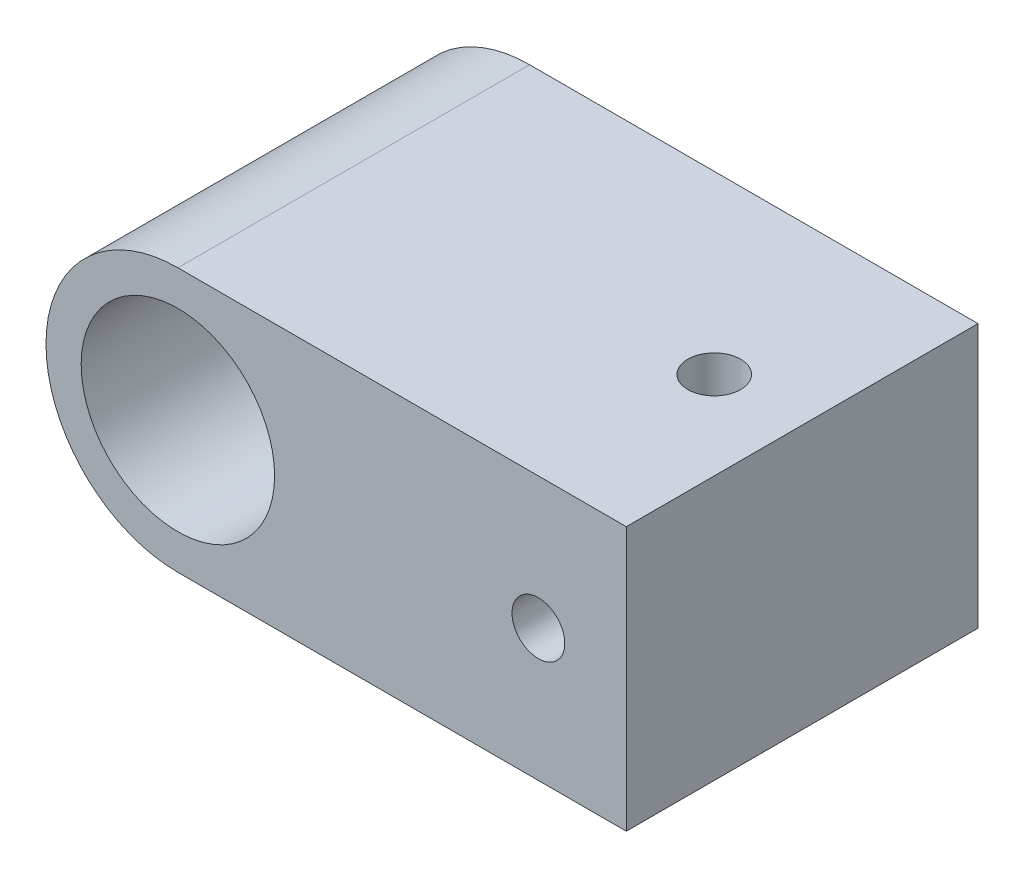
from build123d import *

# Parameters (mm, degrees)
SKETCH1_R           = 7.5
BOSS_EXTRUDE1_DEPTH = 20
SKETCH2_W           = 20
SKETCH2_H           = 15
BOSS_EXTRUDE2_DEPTH = 25.5
SKETCH3_R           = 5.5
CUT_EXTRUDE1_DEPTH  = 26
SKETCH4_R           = 1.5
CUT_EXTRUDE2_DEPTH  = 30
SKETCH5_R           = 1.5
CUT_EXTRUDE3_DEPTH  = 30


with BuildPart() as part:
    # Sketch1 → Boss-Extrude1 (new body)
    with BuildSketch(Plane.XY):
        Circle(SKETCH1_R)
    extrude(amount=BOSS_EXTRUDE1_DEPTH)

    # Sketch2 → Boss-Extrude2 (add)
    with BuildSketch(Plane(origin=(0, 0, 0), x_dir=(0, 0, -1), z_dir=(1, 0, 0))):
        with Locations((-10, 0)):
            Rectangle(SKETCH2_W, SKETCH2_H)
    extrude(amount=BOSS_EXTRUDE2_DEPTH)

    # Sketch3 → Cut-Extrude1 (cut)
    with BuildSketch(Plane.XY.offset(20)):
        Circle(SKETCH3_R)
    extrude(amount=-CUT_EXTRUDE1_DEPTH, mode=Mode.SUBTRACT)

    # Sketch4 → Cut-Extrude2 (cut)
    with BuildSketch(Plane(origin=(0, 7.5, 0), x_dir=(1, 0, 0), z_dir=(0, 1, 0))):
        with Locations(Location((20.5, -10, 0), (0, 0, 270))):
            Circle(SKETCH4_R)
    extrude(amount=-CUT_EXTRUDE2_DEPTH, mode=Mode.SUBTRACT)

    # Sketch5 → Cut-Extrude3 (cut)
    with BuildSketch(Plane(origin=(0, 0, 0), x_dir=(-1, 0, 0), z_dir=(0, 0, -1))):
        with Locations((-20.5, 0)):
            Circle(SKETCH5_R)
    extrude(amount=-CUT_EXTRUDE3_DEPTH, mode=Mode.SUBTRACT)


solid = part.part
